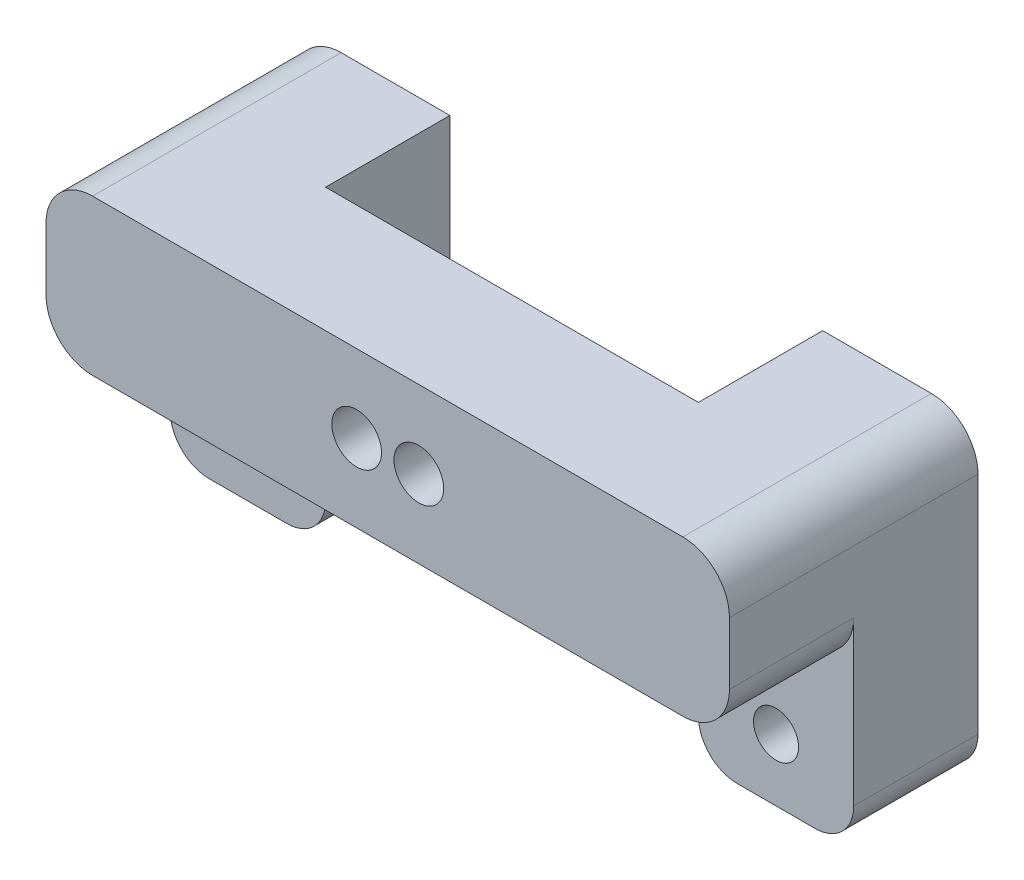
from build123d import *

# Parameters (mm, degrees)
SKETCH1_W           = 44
SKETCH1_H           = 10
BOSS_EXTRUDE1_DEPTH = 8
SKETCH4_W           = 10
SKETCH4_H           = 10
BOSS_EXTRUDE2_DEPTH = 8
SKETCH3_R           = 1.6
CUT_EXTRUDE2_DEPTH  = 48.874836814
SKETCH5_W           = 10
SKETCH5_H           = 8
BOSS_EXTRUDE3_DEPTH = 10
SKETCH6_R           = 1.45
CUT_EXTRUDE3_DEPTH  = 49.989794856
FILLET2_R           = 2.5
FILLET1_R           = 3


with BuildPart() as part:
    # Sketch1 → Boss-Extrude1 (new body)
    with BuildSketch(Plane.XY):
        with Locations((22, -5)):
            Rectangle(SKETCH1_W, SKETCH1_H)
    extrude(amount=BOSS_EXTRUDE1_DEPTH)

    # Sketch4 → Boss-Extrude2 (add)
    with BuildSketch(Plane(origin=(0, 0, 0), x_dir=(-1, 0, 0), z_dir=(0, 0, -1))):
        with Locations((-5, -5)):
            Rectangle(SKETCH4_W, SKETCH4_H)
        with Locations((-39, -5)):
            Rectangle(SKETCH4_W, SKETCH4_H)
    extrude(amount=BOSS_EXTRUDE2_DEPTH)

    # Sketch3 → Cut-Extrude2 (cut, through all)
    with BuildSketch(Plane.XY.offset(8)):
        with Locations((20, -5)):
            Circle(SKETCH3_R)
        with Locations((24, -5)):
            Circle(SKETCH3_R)
    extrude(amount=-CUT_EXTRUDE2_DEPTH, mode=Mode.SUBTRACT)

    # Sketch5 → Boss-Extrude3 (add)
    with BuildSketch(Plane(origin=(0, -10, 0), x_dir=(-1, 0, 0), z_dir=(0, -1, 0))):
        with Locations((-5, 4)):
            Rectangle(SKETCH5_W, SKETCH5_H)
        with Locations((-39, 4)):
            Rectangle(SKETCH5_W, SKETCH5_H)
    extrude(amount=BOSS_EXTRUDE3_DEPTH)

    # Sketch6 → Cut-Extrude3 (cut, through all)
    with BuildSketch(Plane.XY):
        with Locations((5, -16)):
            Circle(SKETCH6_R)
        with Locations((39, -16)):
            Circle(SKETCH6_R)
    extrude(amount=-CUT_EXTRUDE3_DEPTH, mode=Mode.SUBTRACT)

    # Fillet2
    fillet2_edges = [part.edges().sort_by_distance(p)[0] for p in [
        (10, -20, -4),
        (0, -20, -4),
        (34, -20, -4),
        (44, -20, -4),
    ]]
    fillet(fillet2_edges, radius=FILLET2_R)

    # Fillet1
    fillet1_edges = [part.edges().sort_by_distance(p)[0] for p in [
        (0, 0, 0),
        (44, 0, 0),
        (44, -10, 4),
        (0, -10, 4),
    ]]
    fillet(fillet1_edges, radius=FILLET1_R)


solid = part.part
